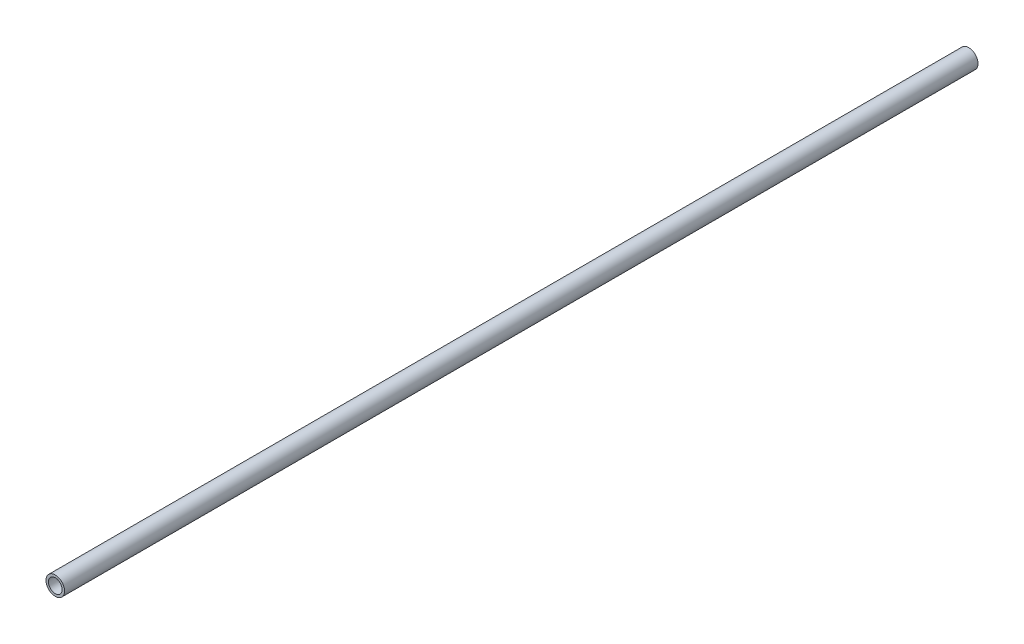
from build123d import *

# Parameters (mm, degrees)
SKETCH1_R           = 10.668
SKETCH1_R_2         = 7.8994
EXTRUDE_THIN1_DEPTH = 525


with BuildPart() as part:
    # Sketch1 → Extrude-Thin1 (new, symmetric)
    with BuildSketch(Plane.XY):
        Circle(SKETCH1_R)
        Circle(SKETCH1_R_2, mode=Mode.SUBTRACT)
    extrude(amount=EXTRUDE_THIN1_DEPTH, both=True)


solid = part.part
